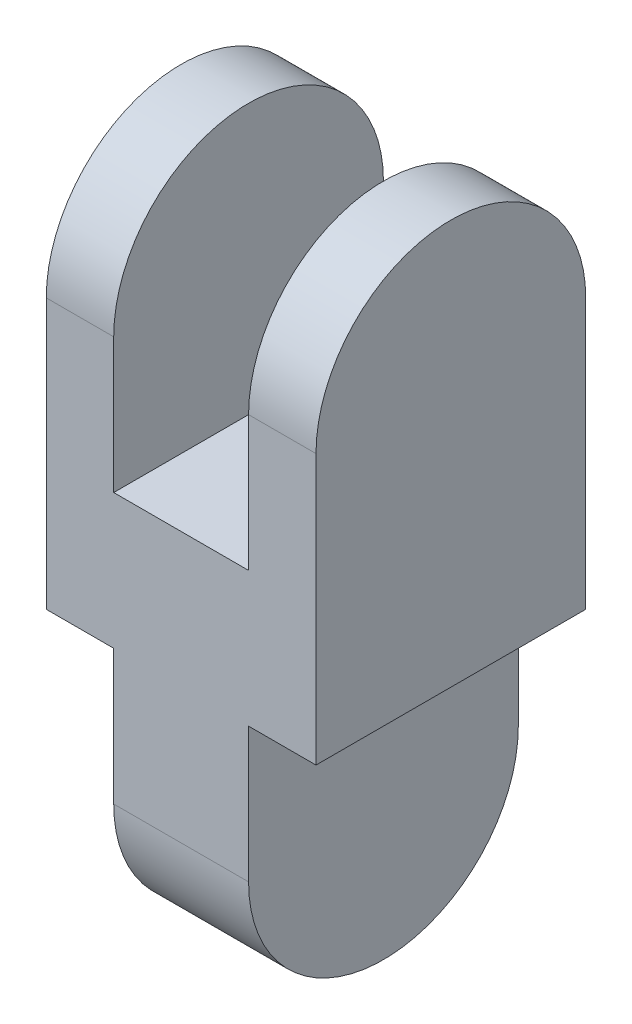
from build123d import *

# Parameters (mm, degrees)
SKETCH_1_W          = 16
SKETCH_1_H          = 16
EXTRUDE_1_DEPTH     = 40
CUT_EXTRUDE_1_DEPTH = 40
CUT_EXTRUDE_START   = -4
CUT_EXTRUDE_2_DEPTH = 4
CUT_EXTRUDE_3_DEPTH = 4
CUT_EXTRUDE_7_DEPTH = 44.8178046
CUT_EXTRUDE_8_DEPTH = 4


with BuildPart() as part:
    # 草图1 → 凸台-拉伸1 (new body)
    with BuildSketch(Plane(origin=(0, 0, 0), x_dir=(1, 0, 0), z_dir=(0, 1, 0))):
        Rectangle(SKETCH_1_W, SKETCH_1_H)
    extrude(amount=EXTRUDE_1_DEPTH)

    # 草图2 → 切除-拉伸1 (cut)
    with BuildSketch(Plane(origin=(8, 0, 0), x_dir=(0, 0, -1), z_dir=(1, 0, 0))):
        with BuildLine():
            Line((-8, 8), (-8, -6.748551072))
            Line((-8, -6.748551072), (8, -6.748551072))
            Line((8, -6.748551072), (8, 8))
            ThreePointArc((8, 8), (0, 0), (-8, 8))
        make_face()
    extrude(amount=-CUT_EXTRUDE_1_DEPTH, mode=Mode.SUBTRACT)

    # 草图4 → 切除-拉伸2 (cut)
    with BuildSketch(Plane.ZY.offset(8).offset(CUT_EXTRUDE_START)):
        with BuildLine():
            Line((-8, 8), (-8, 16))
            Line((-8, 16), (8, 16))
            Line((8, 16), (8, 8))
            ThreePointArc((8, 8), (0, 0), (-8, 8))
        make_face()
    extrude(amount=CUT_EXTRUDE_2_DEPTH, mode=Mode.SUBTRACT)

    # 草图5 → 切除-拉伸3 (cut)
    with BuildSketch(Plane(origin=(8, 0, 0), x_dir=(0, 0, -1), z_dir=(1, 0, 0))):
        with BuildLine():
            Line((-8, 8), (-8, 16))
            Line((-8, 16), (8, 16))
            Line((8, 16), (8, 8))
            ThreePointArc((8, 8), (0, 0), (-8, 8))
        make_face()
    extrude(amount=-CUT_EXTRUDE_3_DEPTH, mode=Mode.SUBTRACT)

    # 草图8 → 切除-拉伸7 (cut, through all)
    with BuildSketch(Plane(origin=(8, 0, 0), x_dir=(0, 0, -1), z_dir=(1, 0, 0))):
        with BuildLine():
            Line((-8, 32), (-8, 44.090265963))
            Line((-8, 44.090265963), (8, 44.090265963))
            Line((8, 44.090265963), (8, 32))
            ThreePointArc((8, 32), (0, 40), (-8, 32))
        make_face()
    extrude(amount=-CUT_EXTRUDE_7_DEPTH, mode=Mode.SUBTRACT)

    # 草图7 → 切除-拉伸8 (cut, symmetric)
    with BuildSketch(Plane(origin=(0, 0, 0), x_dir=(0, 0, -1), z_dir=(1, 0, 0))):
        with BuildLine():
            Line((-8, 32), (-8, 24))
            Line((-8, 24), (8, 24))
            Line((8, 24), (8, 32))
            ThreePointArc((8, 32), (0, 40), (-8, 32))
        make_face()
    extrude(amount=CUT_EXTRUDE_8_DEPTH, both=True, mode=Mode.SUBTRACT)


solid = part.part
